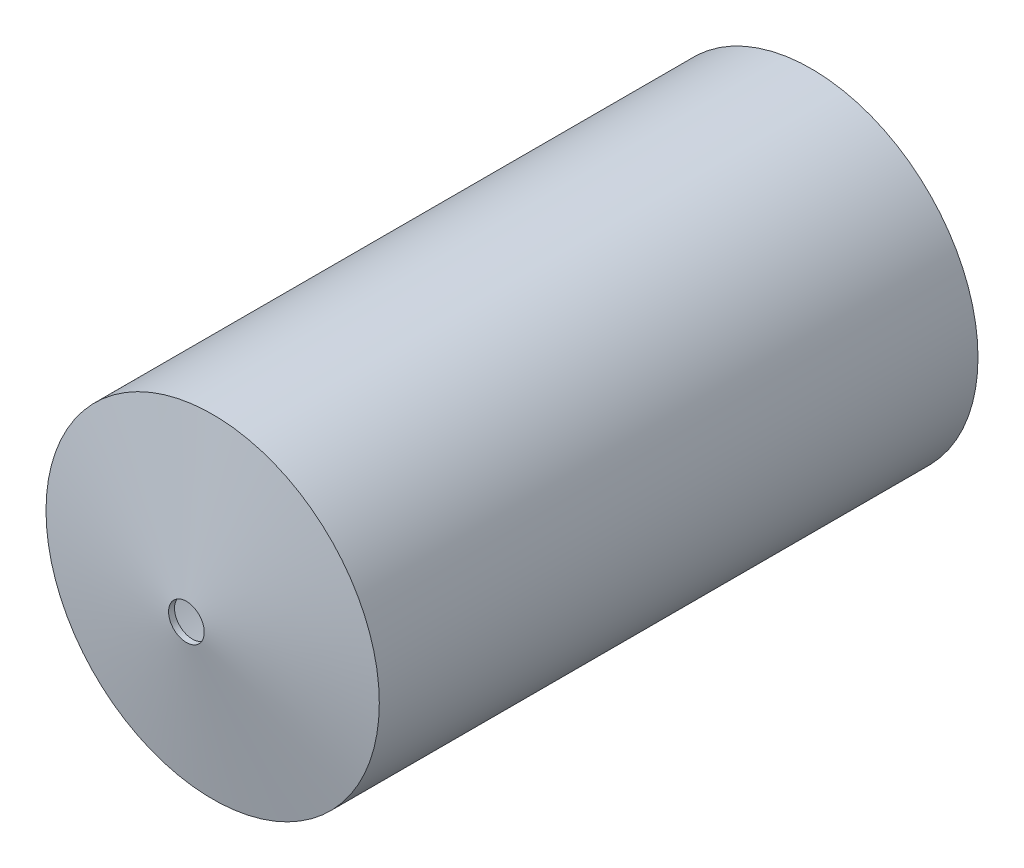
from build123d import *


with BuildPart() as part:
    # Sketch1 → Revolve1 (revolve)
    with BuildSketch(Plane(origin=(0, 0, 0), x_dir=(1, 0, 0), z_dir=(0, 1, 0)), mode=Mode.PRIVATE) as revolve1_sk:
        Polygon((3.81, 0), (35.56, 5.598381637), (35.56, 133.35), (34.29, 133.35), (34.29, 6.644446372), (3.81, 1.27), align=None)
    revolve(revolve1_sk.sketch.rotate(Axis((0, 0, 0), (0, 0, -1)), 180), axis=Axis((0, 0, 0), (0, 0, -1)))


solid = part.part
